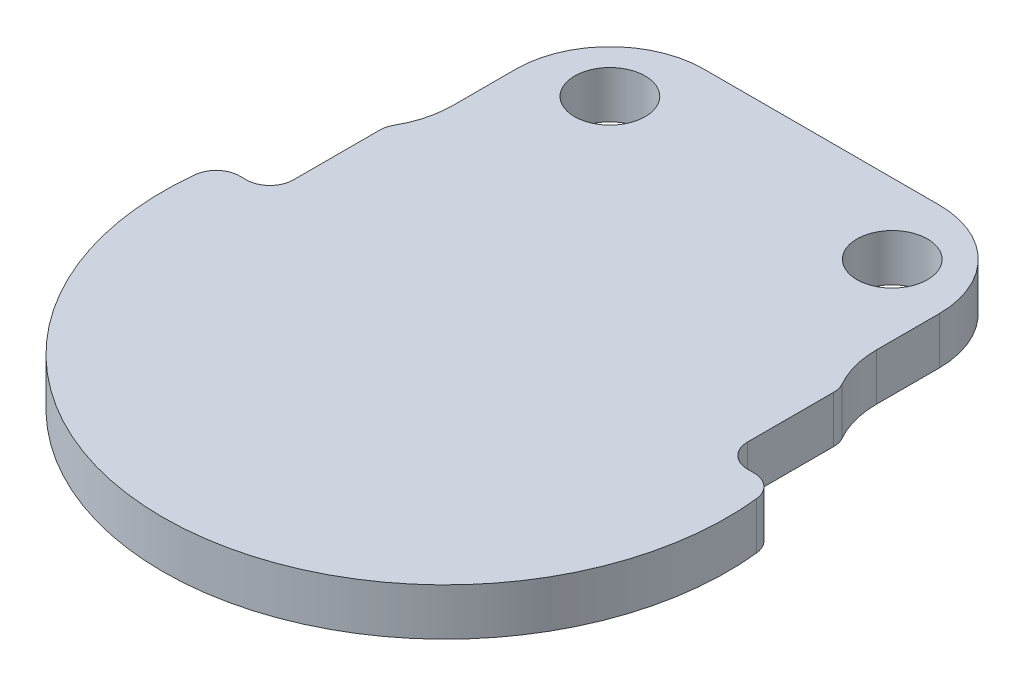
from build123d import *

# Parameters (mm, degrees)
SKETCH1_R           = 1.5
BOSS_EXTRUDE1_DEPTH = 2
FILLET2_R           = 4
CUT_EXTRUDE1_DEPTH  = 21.099751242
FILLET3_R           = 1


with BuildPart() as part:
    # Sketch1 → Boss-Extrude1 (new body)
    with BuildSketch(Plane(origin=(0, 0, 0), x_dir=(1, 0, 0), z_dir=(0, 1, 0))):
        with BuildLine():
            Line((-9, 10), (-9, 7.937253933))
            ThreePointArc((-9, 7.937253933), (0, -12), (9, 7.937253933))
            Line((9, 7.937253933), (9, 10))
            Line((9, 10), (9, 16))
            Line((9, 16), (-9, 16))
            Line((-9, 16), (-9, 10))
        make_face()
        with Locations(Location((-6, 13, 0), (0, 0, 270))):
            Circle(SKETCH1_R, mode=Mode.SUBTRACT)
        with Locations(Location((6, 13, 0), (0, 0, 270))):
            Circle(SKETCH1_R, mode=Mode.SUBTRACT)
    extrude(amount=BOSS_EXTRUDE1_DEPTH)

    # Fillet2
    fillet2_edges = [part.edges().sort_by_distance(p)[0] for p in [
        (9, 1, -7.937253933),
        (-9, 1, -7.937253933),
        (-9, 1, -16),
        (9, 1, -16),
    ]]
    fillet(fillet2_edges, radius=FILLET2_R)

    # Sketch2 → Cut-Extrude1 (cut, through all)
    with BuildSketch(Plane(origin=(0, 2, 0), x_dir=(1, 0, 0), z_dir=(0, 1, 0))):
        with BuildLine():
            Line((-11.796609682, 2.2), (-9.65, 2.2))
            Line((-9.65, 2.2), (-9.65, 7.255695723))
            ThreePointArc((-9.65, 7.255695723), (-11.151781756, 4.909775878), (-11.796609682, 2.2))
        make_face()
        with BuildLine():
            Line((9.65, 2.2), (9.65, 7.255695723))
            ThreePointArc((9.65, 7.255695723), (11.151781756, 4.909775878), (11.796609682, 2.2))
            Line((11.796609682, 2.2), (9.65, 2.2))
        make_face()
    extrude(amount=-CUT_EXTRUDE1_DEPTH, mode=Mode.SUBTRACT)

    # Fillet3
    fillet3_edges = [part.edges().sort_by_distance(p)[0] for p in [
        (-9.65, 1, -7.141629754),
        (-11.796609682, 1, -2.2),
        (-9.65, 1, -2.2),
        (9.65, 1, -7.141629754),
        (9.65, 1, -2.2),
        (11.796609682, 1, -2.2),
    ]]
    fillet(fillet3_edges, radius=FILLET3_R)


solid = part.part
